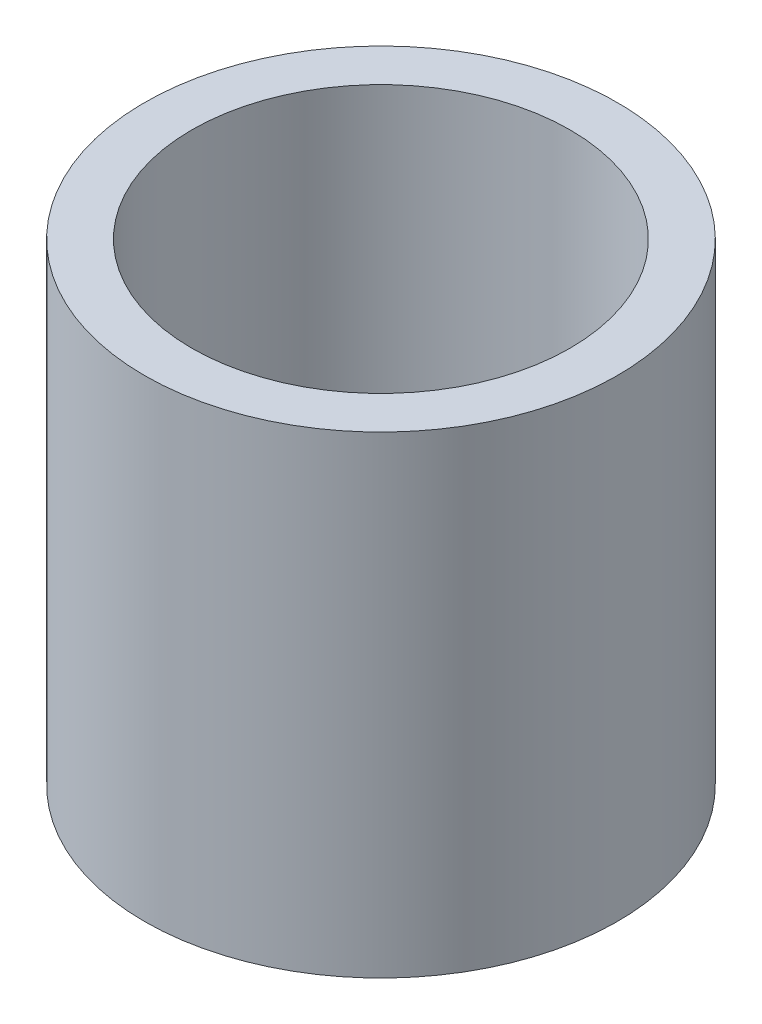
from build123d import *

# Parameters (mm, degrees)
SKETCH1_R           = 4
SKETCH1_R_2         = 2.1
BOSS_EXTRUDE1_DEPTH = 4
SKETCH2_R           = 5
SKETCH2_R_2         = 4
BOSS_EXTRUDE2_DEPTH = 10


with BuildPart() as part:
    # Sketch1 → Boss-Extrude1 (new body)
    with BuildSketch(Plane(origin=(0, 0, 0), x_dir=(1, 0, 0), z_dir=(0, 1, 0))):
        with Locations(Location((0, 0, 0), (0, 0, 270))):
            Circle(SKETCH1_R)
        with Locations(Location((0, 0, 0), (0, 0, 270))):
            Circle(SKETCH1_R_2, mode=Mode.SUBTRACT)
    extrude(amount=BOSS_EXTRUDE1_DEPTH)

    # Sketch2 → Boss-Extrude2 (add)
    with BuildSketch(Plane(origin=(0, 0, 0), x_dir=(1, 0, 0), z_dir=(0, 1, 0))):
        with Locations(Location((0, 0, 0), (0, 0, 270))):
            Circle(SKETCH2_R)
        with Locations(Location((0, 0, 0), (0, 0, 270))):
            Circle(SKETCH2_R_2, mode=Mode.SUBTRACT)
    extrude(amount=BOSS_EXTRUDE2_DEPTH)


solid = part.part
